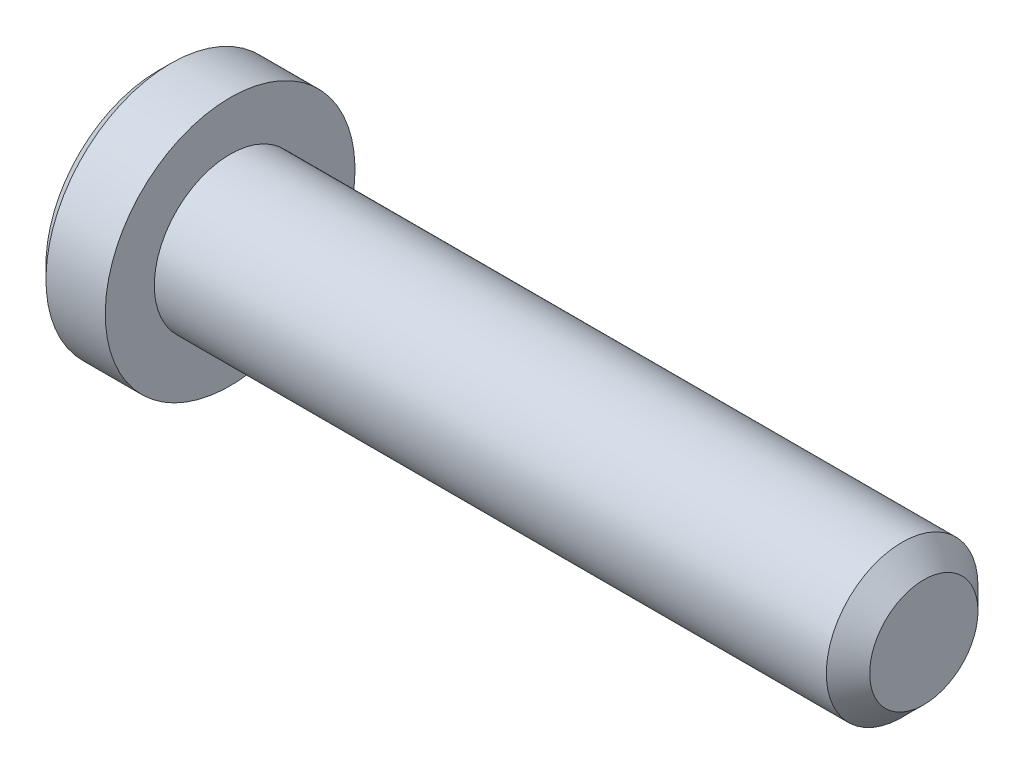
from build123d import *

# Parameters (mm, degrees)
SKETCH2_R           = 2.0828
BOSS_EXTRUDE1_DEPTH = 19.05
CHAMFER1_SIZE       = 0.5953125
CUT_EXTRUDE1_DEPTH  = 1.524


with BuildPart() as part:
    # Sketch2 → Boss-Extrude1 (new body)
    with BuildSketch(Plane(origin=(9.525, 0, 0), x_dir=(0, 0, -1), z_dir=(1, 0, 0))):
        Circle(SKETCH2_R)
    extrude(amount=-BOSS_EXTRUDE1_DEPTH)

    # Chamfer1
    chamfer1_edges = [part.edges().sort_by_distance(p)[0] for p in [
        (9.525, 0, 2.0828),
    ]]
    chamfer(chamfer1_edges, length=CHAMFER1_SIZE)

    # Sketch6 → Revolve1 (revolve)
    with BuildSketch(Plane.XY):
        Polygon((-11.153775, 3.429), (-11.509375, 3.0734), (-11.509375, 0), (-9.525, 0), (-9.525, 3.429), align=None)
    revolve(axis=Axis((-9.525, 0, 0), (-1, 0, 0)))

    # Sketch4 → Cut-Extrude1 (cut)
    with BuildSketch(Plane(origin=(-11.509375, 0, 0), x_dir=(0, 0, -1), z_dir=(1, 0, 0))):
        Polygon((0, 1.14567944), (-0.9921875, 0.57283972), (-0.9921875, -0.57283972), (0, -1.14567944), (0.9921875, -0.57283972), (0.9921875, 0.57283972), align=None)
    extrude(amount=CUT_EXTRUDE1_DEPTH, mode=Mode.SUBTRACT)

    # Cut-Extrude2 cone 1 section (through the dimple's axis) → Cut-Extrude2 (revolve, cut)
    with BuildSketch(Plane(origin=(-11.509375, 0, 0), x_dir=(0, 0, 1), z_dir=(0, 1, 0))):
        Polygon((0, 0), (1.14567944, 0), (0, 1.14567944), align=None)
    revolve(axis=Axis((-11.509375, 0, 0), (1, 0, 0)), mode=Mode.SUBTRACT)


solid = part.part
